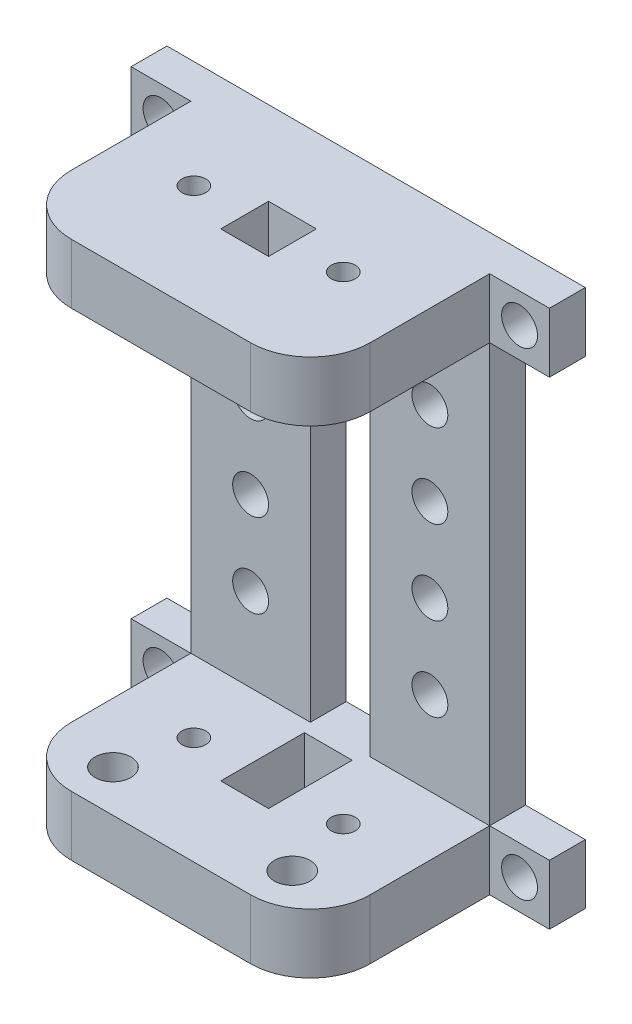
from build123d import *

# Parameters (mm, degrees)
ESBO_O1_R                = 1.5
ESBO_O1_W                = 5
ESBO_O1_H                = 35
RESSALTO_EXTRUS_O1_DEPTH = 3
ESBO_O2_W                = 25
ESBO_O2_H                = 5
RESSALTO_EXTRUS_O2_DEPTH = 15
FILETE5_R                = 5
FILETE6_R                = 5
FILETE7_R                = 5
FILETE8_R                = 5
ESBO_O4_R                = 1
ESBO_O4_W                = 4
ESBO_O4_H                = 4
CORTE_EXTRUS_O2_DEPTH    = 5
CORTE_EXTRUS_O3_START    = -5
ESBO_O3_R                = 1
ESBO_O3_R_2              = 1.5
ESBO_O3_W                = 4
ESBO_O3_H                = 7
CORTE_EXTRUS_O3_DEPTH    = 5


with BuildPart() as part:
    # Esboço1 → Ressalto-extrusão1 (new body)
    with BuildSketch(Plane.XY):
        Polygon((-24.430369357, 7.066666667), (10.569630643, 7.066666667), (10.569630643, 2.066666667), (5.569630643, 2.066666667), (5.569630643, -32.933333333), (10.569630643, -32.933333333), (10.569630643, -37.933333333), (-24.430369357, -37.933333333), (-24.430369357, -32.933333333), (-19.430369357, -32.933333333), (-19.430369357, 2.066666667), (-24.430369357, 2.066666667), align=None)
        with Locations((-14.430369357, -4.933333333)):
            Circle(ESBO_O1_R, mode=Mode.SUBTRACT)
        with Locations((-14.430369357, -11.933333333)):
            Circle(ESBO_O1_R, mode=Mode.SUBTRACT)
        with Locations((-14.430369357, -18.933333333)):
            Circle(ESBO_O1_R, mode=Mode.SUBTRACT)
        with Locations((0.569630643, -4.933333333)):
            Circle(ESBO_O1_R, mode=Mode.SUBTRACT)
        with Locations((0.569630643, -18.933333333)):
            Circle(ESBO_O1_R, mode=Mode.SUBTRACT)
        with Locations((0.569630643, -25.933333333)):
            Circle(ESBO_O1_R, mode=Mode.SUBTRACT)
        with Locations((-14.430369357, -25.933333333)):
            Circle(ESBO_O1_R, mode=Mode.SUBTRACT)
        with Locations((0.569630643, -11.933333333)):
            Circle(ESBO_O1_R, mode=Mode.SUBTRACT)
        with Locations((-21.930369357, 4.566666667)):
            Circle(ESBO_O1_R, mode=Mode.SUBTRACT)
        with Locations((8.069630643, 4.566666667)):
            Circle(ESBO_O1_R, mode=Mode.SUBTRACT)
        with Locations((-21.930369357, -35.433333333)):
            Circle(ESBO_O1_R, mode=Mode.SUBTRACT)
        with Locations((8.069630643, -35.433333333)):
            Circle(ESBO_O1_R, mode=Mode.SUBTRACT)
        with Locations((-6.930369357, -15.433333333)):
            Rectangle(ESBO_O1_W, ESBO_O1_H, mode=Mode.SUBTRACT)
    extrude(amount=-RESSALTO_EXTRUS_O1_DEPTH)

    # Esboço2 → Ressalto-extrusão2 (add)
    with BuildSketch(Plane.XY):
        with Locations((-6.930369357, 4.566666667)):
            Rectangle(ESBO_O2_W, ESBO_O2_H)
        with Locations((-6.930369357, -35.433333333)):
            Rectangle(ESBO_O2_W, ESBO_O2_H)
    extrude(amount=RESSALTO_EXTRUS_O2_DEPTH)

    # Filete5
    filete5_edges = [part.edges().sort_by_distance(p)[0] for p in [
        (5.569630643, -35.433333333, 15),
    ]]
    fillet(filete5_edges, radius=FILETE5_R)

    # Filete6
    filete6_edges = [part.edges().sort_by_distance(p)[0] for p in [
        (-19.430369357, -35.433333333, 15),
    ]]
    fillet(filete6_edges, radius=FILETE6_R)

    # Filete7
    filete7_edges = [part.edges().sort_by_distance(p)[0] for p in [
        (-19.430369357, 4.566666667, 15),
    ]]
    fillet(filete7_edges, radius=FILETE7_R)

    # Filete8
    filete8_edges = [part.edges().sort_by_distance(p)[0] for p in [
        (5.569630643, 4.566666667, 15),
    ]]
    fillet(filete8_edges, radius=FILETE8_R)

    # Esboço4 → Corte-extrusão2 (cut)
    with BuildSketch(Plane(origin=(0, 7.066666667, 0), x_dir=(1, 0, 0), z_dir=(0, 1, 0))):
        with Locations(Location((-13.180369357, -6, 0), (0, 0, 180))):
            Circle(ESBO_O4_R)
        with Locations(Location((-0.680369357, -6, 0), (0, 0, 180))):
            Circle(ESBO_O4_R)
        with Locations((-6.930369357, -6)):
            Rectangle(ESBO_O4_W, ESBO_O4_H)
    extrude(amount=-CORTE_EXTRUS_O2_DEPTH, mode=Mode.SUBTRACT)

    # Esboço3 → Corte-extrusão3 (cut)
    with BuildSketch(Plane(origin=(0, -37.933333333, 0), x_dir=(-1, 0, 0), z_dir=(0, -1, 0)).offset(CORTE_EXTRUS_O3_START)):
        with Locations((13.180369357, -6)):
            Circle(ESBO_O3_R)
        with Locations(Location((0.680369357, -6.000000354, 0), (0, 0, 2.0294e-05))):
            Circle(ESBO_O3_R)
        with Locations(Location((14.430369357, -11.516860689, 0), (0, 0, 180))):
            Circle(ESBO_O3_R_2)
        with Locations(Location((-0.569630643, -11.516860689, 0), (0, 0, 180))):
            Circle(ESBO_O3_R_2)
        with Locations((6.930369357, -4.5)):
            Rectangle(ESBO_O3_W, ESBO_O3_H)
    extrude(amount=CORTE_EXTRUS_O3_DEPTH, mode=Mode.SUBTRACT)


solid = part.part
